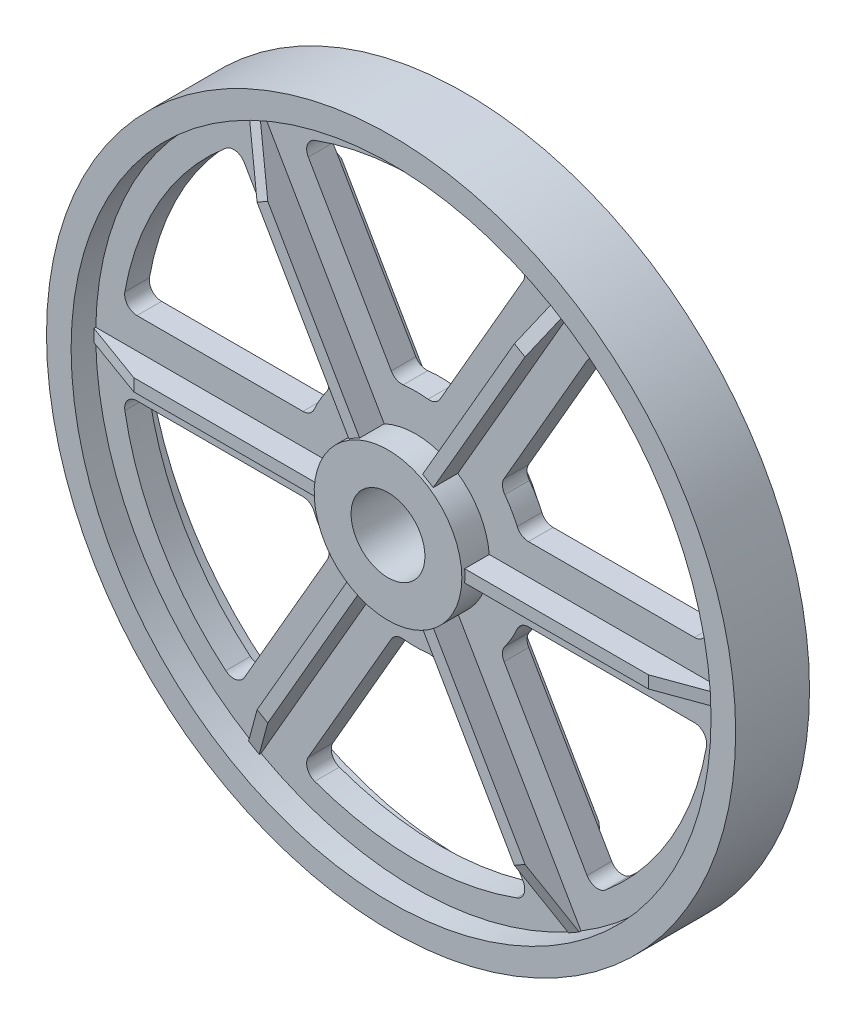
from build123d import *

# Parameters (mm, degrees)
SKETCH1_R                = 38.1
CENTERHUB_DEPTH          = 20.6375
RIB_DEPTH                = 3.175
LIGHTENING_HOLE_DEPTH    = 253.292660231
FILLET1_R                = 6.35
CIRPATTERN1_COUNT        = 6
FILLET1_OF_CIRPATTERN1_R = 6.35
THRU_HOLE_DEPTH          = 253.292660231
THRU_HOLE_DEPTH_BACK     = 253.292660231
SKETCH5_R                = 19.05


with BuildPart() as part:
    # Sketch1 → CenterHub (new, symmetric)
    with BuildSketch(Plane.XY):
        Circle(SKETCH1_R)
    extrude(amount=CENTERHUB_DEPTH, both=True)

    # Sketch2 → Rim and Web (revolve)
    with BuildSketch(Plane(origin=(0, 0, 0), x_dir=(0, 0, -1), z_dir=(1, 0, 0)), mode=Mode.PRIVATE) as rim_and_web_sk:
        Polygon((-6.35, 0), (6.35, 0), (6.35, 165.1), (19.05, 165.1), (19.05, 177.8), (-19.05, 177.8), (-19.05, 165.1), (-6.35, 165.1), align=None)
    revolve(rim_and_web_sk.sketch.rotate(Axis((0, 0, 0), (0, 0, -1)), 90), axis=Axis((0, 0, 0), (0, 0, -1)))

    # Sketch3 → Rib (add, symmetric)
    with BuildSketch(Plane(origin=(0, 0, 0), x_dir=(1, 0, 0), z_dir=(0, 1, 0))):
        Polygon((0, -19.05), (132.747036773, -19.05), (167.64, -6.35), (167.64, 6.35), (132.747036773, 19.05), (0, 19.05), align=None)
    rib = extrude(amount=RIB_DEPTH, both=True)

    # Sketch4 → Lightening hole (cut, symmetric)
    with BuildSketch(Plane.XY):
        with BuildLine():
            Line((92.100127656, -121.422100483), (43.438552305, -37.1377796))
            ThreePointArc((43.438552305, -37.1377796), (49.493351826, -28.575), (53.881536726, -19.05))
            Line((53.881536726, -19.05), (151.204687427, -19.05))
            ThreePointArc((151.204687427, -19.05), (131.982271537, -76.2), (92.100127656, -121.422100483))
        make_face()
    lightening_hole = extrude(amount=LIGHTENING_HOLE_DEPTH, both=True, mode=Mode.SUBTRACT)

    # Fillet1
    fillet1_edges = [part.edges().sort_by_distance(p)[0] for p in [
        (151.204687427, -19.05, 0),
        (92.100127656, -121.422100483, 0),
        (43.438552305, -37.1377796, 0),
        (53.881536726, -19.05, 0),
    ]]
    fillet(fillet1_edges, radius=FILLET1_R)

    # CirPattern1: Rib, Lightening hole ×6 about axis
    cirpattern1_axis = Axis((0, 0, 0), (0, 0, 1))
    add([rib.rotate(cirpattern1_axis, i * 360 / CIRPATTERN1_COUNT) for i in range(1, CIRPATTERN1_COUNT)])
    add([lightening_hole.rotate(cirpattern1_axis, i * 360 / CIRPATTERN1_COUNT) for i in range(1, CIRPATTERN1_COUNT)], mode=Mode.SUBTRACT)

    # Fillet1 of CirPattern1
    fillet1_of_cirpattern1_edges = [part.edges().sort_by_distance(p)[0] for p in [
        (92.100127656, 121.422100483, 0),
        (151.204687427, 19.05, 0),
        (53.881536726, 19.05, 0),
        (43.438552305, 37.1377796, 0),
        (-59.104559772, 140.472100483, 0),
        (59.104559772, 140.472100483, 0),
        (10.442984421, 56.1877796, 0),
        (-10.442984421, 56.1877796, 0),
        (-151.204687427, 19.05, 0),
        (-92.100127656, 121.422100483, 0),
        (-43.438552305, 37.1377796, 0),
        (-53.881536726, 19.05, 0),
        (-92.100127656, -121.422100483, 0),
        (-151.204687427, -19.05, 0),
        (-53.881536726, -19.05, 0),
        (-43.438552305, -37.1377796, 0),
        (59.104559772, -140.472100483, 0),
        (-59.104559772, -140.472100483, 0),
        (-10.442984421, -56.1877796, 0),
        (10.442984421, -56.1877796, 0),
    ]]
    fillet(fillet1_of_cirpattern1_edges, radius=FILLET1_OF_CIRPATTERN1_R)

    # Sketch5 → Thru hole (cut, two sides: drawn at the far end of the back side and taken through both)
    with BuildSketch(Plane.XY.offset(-THRU_HOLE_DEPTH_BACK)):
        Circle(SKETCH5_R)
    extrude(amount=THRU_HOLE_DEPTH + THRU_HOLE_DEPTH_BACK, mode=Mode.SUBTRACT)


solid = part.part
